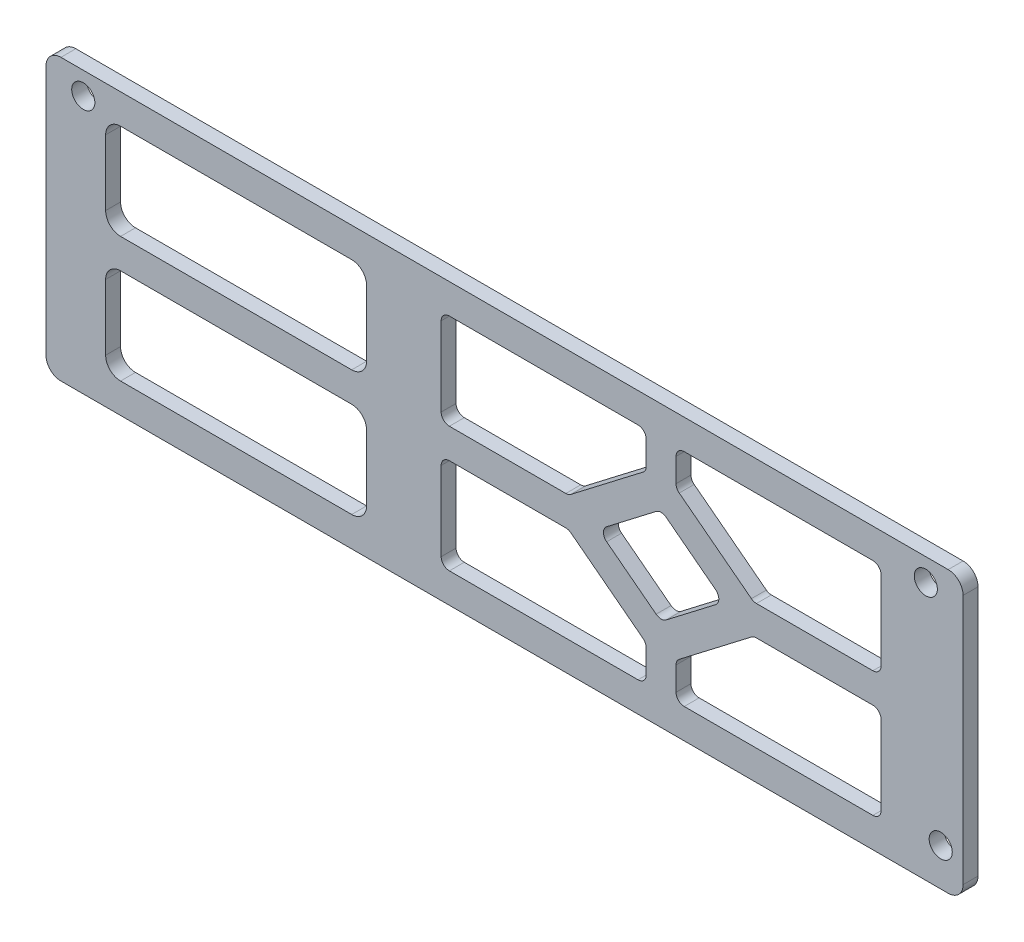
from build123d import *

# Parameters (mm, degrees)
SKETCH_1_W          = 123
SKETCH_1_H          = 37.6
EXTRUDE_1_DEPTH     = 2
SKETCH_2_R          = 1.55
CUT_EXTRUDE_1_DEPTH = 10
SKETCH_3_W          = 35
SKETCH_3_H          = 29.6
CUT_EXTRUDE_2_DEPTH = 10
FILLET_1_R          = 2
SKETCH_4_W          = 4
SKETCH_4_H          = 4
CUT_EXTRUDE_3_DEPTH = 10
FILLET_2_R          = 1.1
SKETCH_5_W          = 35
SKETCH_5_H          = 4
EXTRUDE_1_2_DEPTH   = 2
FILLET_3_R          = 2


with BuildPart() as part:
    # 草图1 → Extrude 1 (new body)
    with BuildSketch(Plane.XY):
        Rectangle(SKETCH_1_W, SKETCH_1_H)
    extrude(amount=EXTRUDE_1_DEPTH)

    # 草图2 → 切除-拉伸1 (cut)
    with BuildSketch(Plane.XY.offset(2)):
        with Locations((56.5, 15.8)):
            Circle(SKETCH_2_R)
        with Locations((58.5, -13.75)):
            Circle(SKETCH_2_R)
        with Locations((-56.5, 15.8)):
            Circle(SKETCH_2_R)
    extrude(amount=-CUT_EXTRUDE_1_DEPTH, mode=Mode.SUBTRACT)

    # 草图3 → 切除-拉伸2 (cut)
    with BuildSketch(Plane.XY.offset(2)):
        with Locations((-36, 0)):
            Rectangle(SKETCH_3_W, SKETCH_3_H)
    extrude(amount=-CUT_EXTRUDE_2_DEPTH, mode=Mode.SUBTRACT)

    # 圆角1
    fillet_1_edges = [part.edges().sort_by_distance(p)[0] for p in [
        (-18.5, 14.8, 1),
        (-18.5, -14.8, 1),
        (-53.5, -14.8, 1),
        (-53.5, 14.8, 1),
        (61.5, -18.8, 1),
        (-61.5, -18.8, 1),
        (-61.5, 18.8, 1),
        (61.5, 18.8, 1),
    ]]
    fillet(fillet_1_edges, radius=FILLET_1_R)

    # 草图4 → 切除-拉伸3 (cut)
    with BuildSketch(Plane.XY.offset(2)):
        Polygon((23, -9.986290852), (23, -14.8), (50.5, -14.8), (50.5, -2), (33.407936873, -2), align=None)
        Polygon((33.407936873, 2), (50.5, 2), (50.5, 14.8), (23, 14.8), (23, 9.986290852), align=None)
        Polygon((-8.5, 14.8), (-8.5, 2), (8.592063127, 2), (19, 9.986290852), (19, 14.8), align=None)
        Polygon((-8.5, -2), (-8.5, -14.8), (19, -14.8), (19, -9.986290852), (8.592063127, -2), align=None)
        Polygon((23, -2), (26.837218346, -2), (29.443669092, 0), (26.837218346, 2), (23, 2), align=None)
        Polygon((23, -2), (23, -4.944401196), (26.837218346, -2), align=None)
        Polygon((19, -2), (19, -4.944401196), (21, -6.479055172), (23, -4.944401196), (23, -2), align=None)
        Polygon((15.162781654, -2), (19, -4.944401196), (19, -2), align=None)
        Polygon((12.556330908, 0), (15.162781654, -2), (19, -2), (19, 2), (15.162781654, 2), align=None)
        Polygon((19, 4.944401196), (15.162781654, 2), (19, 2), align=None)
        Polygon((19, 4.944401196), (19, 2), (23, 2), (23, 4.944401196), (21, 6.479055172), align=None)
        Polygon((23, 4.944401196), (23, 2), (26.837218346, 2), align=None)
        with Locations((21, 0)):
            Rectangle(SKETCH_4_W, SKETCH_4_H)
    extrude(amount=-CUT_EXTRUDE_3_DEPTH, mode=Mode.SUBTRACT)

    # 圆角2
    fillet_2_edges = [part.edges().sort_by_distance(p)[0] for p in [
        (33.407936873, 2, 1),
        (23, 9.986290852, 1),
        (23, 14.8, 1),
        (50.5, 14.8, 1),
        (50.5, 2, 1),
        (-8.5, 2, 1),
        (-8.5, 14.8, 1),
        (19, 14.8, 1),
        (19, 9.986290852, 1),
        (8.592063127, 2, 1),
        (21, 6.479055172, 1),
        (29.443669092, 0, 1),
        (21, -6.479055172, 1),
        (12.556330908, 0, 1),
        (-8.5, -2, 1),
        (8.592063127, -2, 1),
        (19, -9.986290852, 1),
        (19, -14.8, 1),
        (-8.5, -14.8, 1),
        (23, -9.986290852, 1),
        (33.407936873, -2, 1),
        (50.5, -2, 1),
        (50.5, -14.8, 1),
        (23, -14.8, 1),
    ]]
    fillet(fillet_2_edges, radius=FILLET_2_R)

    # 草图5 → Extrude 1 2 (add)
    with BuildSketch(Plane.XY.offset(2)):
        with Locations((-36, 0)):
            Rectangle(SKETCH_5_W, SKETCH_5_H)
    extrude(amount=-EXTRUDE_1_2_DEPTH)

    # 圆角3
    fillet_3_edges = [part.edges().sort_by_distance(p)[0] for p in [
        (-53.5, 2, 1),
        (-18.5, 2, 1),
        (-18.5, -2, 1),
        (-53.5, -2, 1),
    ]]
    fillet(fillet_3_edges, radius=FILLET_3_R)


solid = part.part
